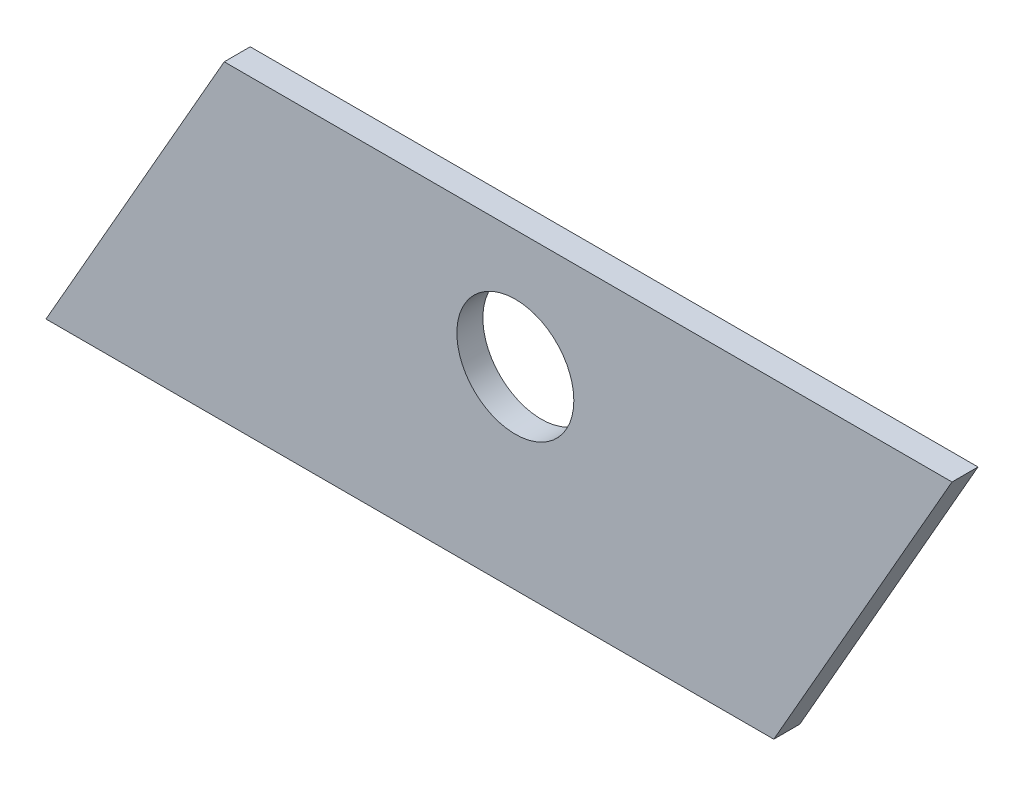
from build123d import *

# Parameters (mm, degrees)
BOSS_EXTRUDE1_DEPTH = 3.175
SKETCH3_R           = 14.2875
CUT_EXTRUDE2_DEPTH  = 140.420656474


with BuildPart() as part:
    # Sketch1 → Boss-Extrude1 (new, symmetric)
    with BuildSketch(Plane.XY):
        Polygon((-88.9, -43.089285714), (88.9, -43.089285714), (132.442857143, 33.110714286), (-45.357142857, 33.110714286), align=None)
    extrude(amount=BOSS_EXTRUDE1_DEPTH, both=True)

    # Sketch3 → Cut-Extrude2 (cut, through all)
    with BuildSketch(Plane.XY.offset(3.175)):
        with Locations((25.762857143, 4.154714286)):
            Circle(SKETCH3_R)
    extrude(amount=-CUT_EXTRUDE2_DEPTH, mode=Mode.SUBTRACT)


solid = part.part
